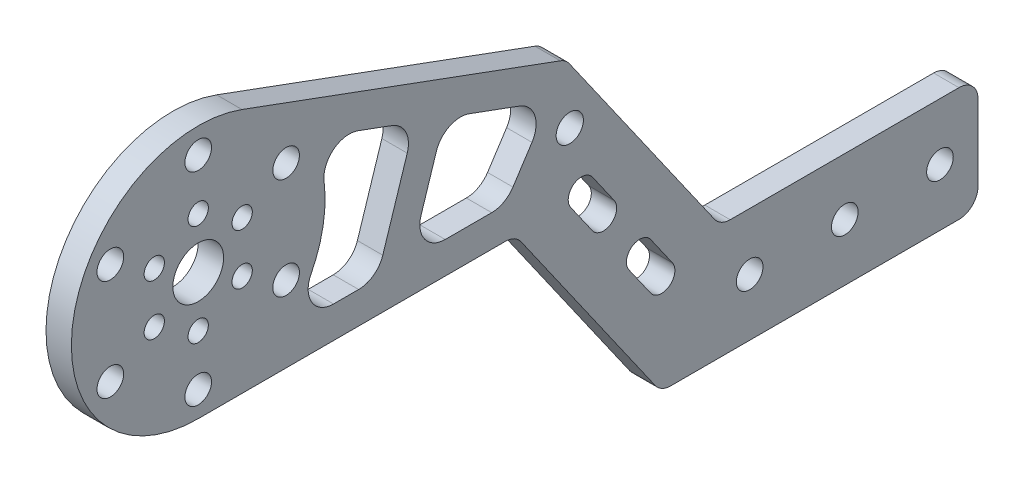
from build123d import *

# Parameters (mm, degrees)
SKETCH_1_R          = 20
SKETCH_1_R_2        = 2.1
SKETCH_1_R_3        = 1.6
SKETCH_1_R_4        = 4
EXTRUDE_1_DEPTH     = 4
EXTRUDE_START       = -4
SKETCH_2_R          = 2.1
EXTRUDE_2_DEPTH     = 4
FILLET_1_R          = 3
CUT_EXTRUDE_START   = -4
CUT_EXTRUDE_1_DEPTH = 4
FILLET_2_R          = 4
SKETCH_4_R          = 2.15
CUT_EXTRUDE_2_DEPTH = 4


with BuildPart() as part:
    # 草图1 → 凸台-拉伸1 (new body)
    with BuildSketch(Plane(origin=(0, 0, 0), x_dir=(0, 0, -1), z_dir=(1, 0, 0))):
        Circle(SKETCH_1_R)
        with Locations((0, 16)):
            Circle(SKETCH_1_R_2, mode=Mode.SUBTRACT)
        with Locations((13.856406461, 8)):
            Circle(SKETCH_1_R_2, mode=Mode.SUBTRACT)
        with Locations((13.856406461, -8)):
            Circle(SKETCH_1_R_2, mode=Mode.SUBTRACT)
        with Locations((0, -16)):
            Circle(SKETCH_1_R_2, mode=Mode.SUBTRACT)
        with Locations((-13.856406461, -8)):
            Circle(SKETCH_1_R_2, mode=Mode.SUBTRACT)
        with Locations((-13.856406461, 8)):
            Circle(SKETCH_1_R_2, mode=Mode.SUBTRACT)
        with Locations((0, 8)):
            Circle(SKETCH_1_R_3, mode=Mode.SUBTRACT)
        with Locations((6.92820323, 4)):
            Circle(SKETCH_1_R_3, mode=Mode.SUBTRACT)
        with Locations((6.92820323, -4)):
            Circle(SKETCH_1_R_3, mode=Mode.SUBTRACT)
        with Locations((0, -8)):
            Circle(SKETCH_1_R_3, mode=Mode.SUBTRACT)
        with Locations((-6.92820323, -4)):
            Circle(SKETCH_1_R_3, mode=Mode.SUBTRACT)
        with Locations((-6.92820323, 4)):
            Circle(SKETCH_1_R_3, mode=Mode.SUBTRACT)
        Circle(SKETCH_1_R_4, mode=Mode.SUBTRACT)
    extrude(amount=EXTRUDE_1_DEPTH)

    # 草图2 → 凸台-拉伸2 (add)
    with BuildSketch(Plane(origin=(4, 0, 0), x_dir=(0, 0, -1), z_dir=(1, 0, 0)).offset(EXTRUDE_START)):
        with BuildLine():
            Line((0, -20), (50, -20))
            Line((50, -20), (72.943057454, -52.766081772))
            Line((72.943057454, -52.766081772), (122.943057454, -52.766081772))
            Line((122.943057454, -52.766081772), (122.943057454, -34.766081772))
            Line((122.943057454, -34.766081772), (82.313264364, -34.766081772))
            Line((82.313264364, -34.766081772), (57.969791834, 0))
            Line((57.969791834, 0), (6.90014553, 18.772000204))
            ThreePointArc((6.90014553, 18.772000204), (19.69060695, -3.504282802), (0, -20))
        make_face()
        with Locations((86.943057454, -43.766081772)):
            Circle(SKETCH_2_R, mode=Mode.SUBTRACT)
        with Locations((101.943057454, -43.766081772)):
            Circle(SKETCH_2_R, mode=Mode.SUBTRACT)
        with Locations((116.943057454, -43.766081772)):
            Circle(SKETCH_2_R, mode=Mode.SUBTRACT)
    extrude(amount=EXTRUDE_2_DEPTH)

    # 圆角1
    fillet_1_edges = [part.edges().sort_by_distance(p)[0] for p in [
        (2, -52.766081772, -122.943057454),
        (2, -52.766081772, -72.943057454),
        (2, -20, -50),
        (2, 0, -57.969791834),
        (2, -34.766081772, -82.313264364),
        (2, -34.766081772, -122.943057454),
    ]]
    fillet(fillet_1_edges, radius=FILLET_1_R)

    # 草图3 → 切除-拉伸1 (cut)
    with BuildSketch(Plane(origin=(4, 0, 0), x_dir=(0, 0, -1), z_dir=(1, 0, 0)).offset(CUT_EXTRUDE_START)):
        with BuildLine():
            Line((34.128214656, 3.436519896), (17.591620185, 9.514982882))
            ThreePointArc((17.591620185, 9.514982882), (19.38855853, 4.907524645), (20, 0))
            ThreePointArc((20, 0), (18.228756555, -8.228756555), (13.228756555, -15))
            Line((13.228756555, -15), (28.207788247, -15))
            Line((28.207788247, -15), (34.128214656, 3.436519896))
        make_face()
        Polygon((55.36185792, -4.368467695), (38.825263449, 1.709995291), (33.459267156, -15), (48.438298848, -15), align=None)
        with BuildLine():
            Line((58.713872022, -20.497149546), (62.15533064, -25.412061811))
            ThreePointArc((62.15533064, -25.412061811), (65.080060449, -25.927770588), (65.595769226, -23.003040779))
            Line((65.595769226, -23.003040779), (62.154310608, -18.088128513))
            ThreePointArc((62.154310608, -18.088128513), (59.229580798, -17.572419736), (58.713872022, -20.497149546))
        make_face()
        with BuildLine():
            Line((67.891095003, -33.603582254), (71.332553621, -38.51849452))
            ThreePointArc((71.332553621, -38.51849452), (74.257283431, -39.034203297), (74.772992207, -36.109473487))
            Line((74.772992207, -36.109473487), (71.331533589, -31.194561222))
            ThreePointArc((71.331533589, -31.194561222), (68.40680378, -30.678852445), (67.891095003, -33.603582254))
        make_face()
    extrude(amount=CUT_EXTRUDE_1_DEPTH, mode=Mode.SUBTRACT)

    # 圆角2
    fillet_2_edges = [part.edges().sort_by_distance(p)[0] for p in [
        (2, 1.709995291, -38.825263449),
        (2, -4.368467695, -55.36185792),
        (2, -15, -48.438298848),
        (2, -15, -33.459267156),
        (2, -15, -13.228756555),
        (2, 9.514982882, -17.591620185),
        (2, 3.436519896, -34.128214656),
        (2, -15, -28.207788247),
    ]]
    fillet(fillet_2_edges, radius=FILLET_2_R)

    # 草图4 → 切除-拉伸2 (cut)
    with BuildSketch(Plane(origin=(4, 0, 0), x_dir=(0, 0, -1), z_dir=(1, 0, 0))):
        with Locations((58.578753333, -9.586921129)):
            Circle(SKETCH_4_R)
    extrude(amount=-CUT_EXTRUDE_2_DEPTH, mode=Mode.SUBTRACT)


solid = part.part
